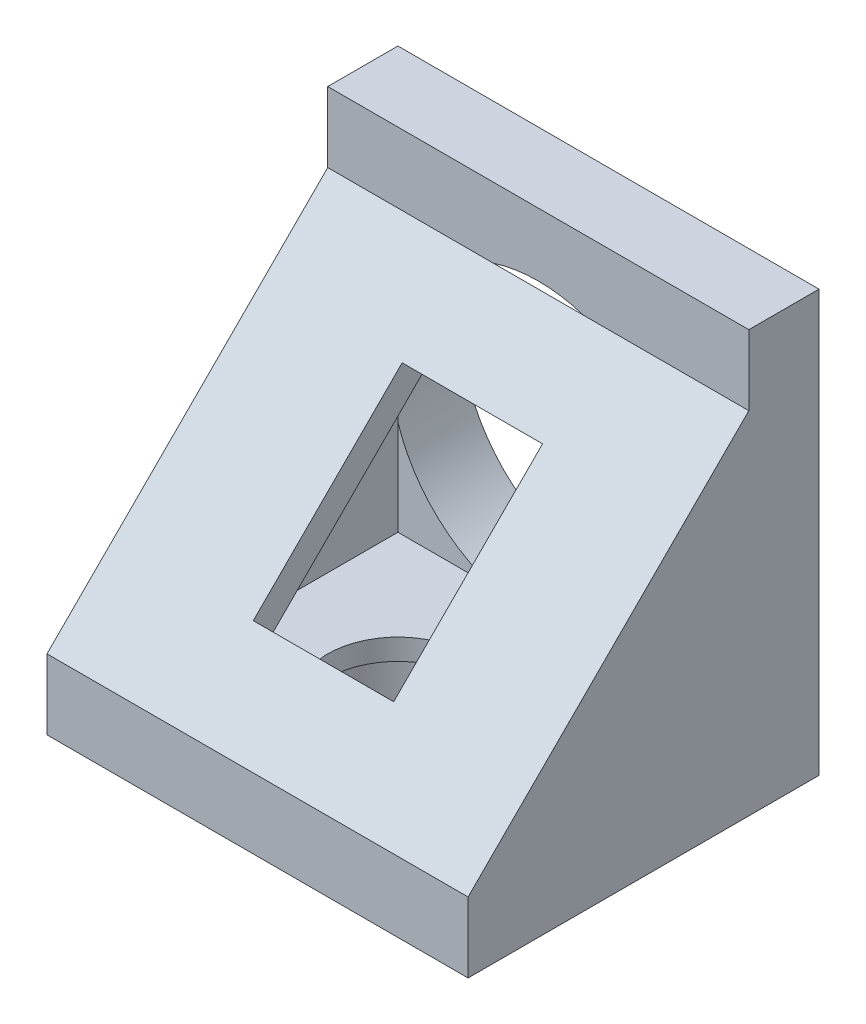
from build123d import *

# Parameters (mm, degrees)
SKETCH1_W           = 30
SKETCH1_H           = 30
BOSS_EXTRUDE1_DEPTH = 25
SKETCH2_W           = 20
SKETCH2_H           = 20
CUT_EXTRUDE1_DEPTH  = 20
CUT_EXTRUDE2_DEPTH  = 43
SKETCH4_W           = 30
SKETCH4_H           = 28.284271248
SKETCH4_W_2         = 10
SKETCH4_H_2         = 15
BOSS_EXTRUDE2_DEPTH = 2
SKETCH5_R           = 10.5
CUT_EXTRUDE4_DEPTH  = 5
SKETCH6_R           = 5
CUT_EXTRUDE6_DEPTH  = 5
SKETCH7_R           = 6.5
SKETCH7_R_2         = 5
CUT_EXTRUDE7_DEPTH  = 3.5


with BuildPart() as part:
    # Sketch1 → Boss-Extrude1 (new body)
    with BuildSketch(Plane(origin=(0, 0, 0), x_dir=(0, 1, 0), z_dir=(0, 0, 1))):
        Rectangle(SKETCH1_W, SKETCH1_H)
    extrude(amount=BOSS_EXTRUDE1_DEPTH)

    # Sketch2 → Cut-Extrude1 (cut)
    with BuildSketch(Plane.XY.offset(25)):
        Rectangle(SKETCH2_W, SKETCH2_H)
    extrude(amount=-CUT_EXTRUDE1_DEPTH, mode=Mode.SUBTRACT)

    # Sketch3 → Cut-Extrude2 (cut)
    with BuildSketch(Plane.YZ.offset(15)):
        Polygon((15, 25), (-10, 25), (10, 5), (15, 5), align=None)
    extrude(amount=-CUT_EXTRUDE2_DEPTH, mode=Mode.SUBTRACT)

    # Sketch4 → Boss-Extrude2 (add)
    with BuildSketch(Plane(origin=(0, 7.5, 7.5), x_dir=(-1, 0, 0), z_dir=(0, 0.7071067811865477, 0.7071067811865475))):
        with Locations((0, 10.606601718)):
            Rectangle(SKETCH4_W, SKETCH4_H)
        with Locations((0, 10.606601718)):
            Rectangle(SKETCH4_W_2, SKETCH4_H_2, mode=Mode.SUBTRACT)
    extrude(amount=-BOSS_EXTRUDE2_DEPTH)

    # Sketch5 → Cut-Extrude4 (cut)
    with BuildSketch(Plane(origin=(0, 0, 0), x_dir=(1, 0, 0), z_dir=(0, 0, -1))):
        with Locations(Location((0, 0, 0), (0, 0, 180))):
            Circle(SKETCH5_R)
    extrude(amount=-CUT_EXTRUDE4_DEPTH, mode=Mode.SUBTRACT)

    # Sketch6 → Cut-Extrude6 (cut)
    with BuildSketch(Plane.XZ.offset(15)):
        with Locations(Location((0, 15, 0), (0, 0, 270))):
            Circle(SKETCH6_R)
    extrude(amount=-CUT_EXTRUDE6_DEPTH, mode=Mode.SUBTRACT)

    # Sketch7 → Cut-Extrude7 (cut)
    with BuildSketch(Plane.XZ.offset(15)):
        with Locations(Location((0, 15, 0), (0, 0, 270))):
            Circle(SKETCH7_R)
        with Locations(Location((0, 15, 0), (0, 0, 270))):
            Circle(SKETCH7_R_2, mode=Mode.SUBTRACT)
    extrude(amount=-CUT_EXTRUDE7_DEPTH, mode=Mode.SUBTRACT)


solid = part.part
